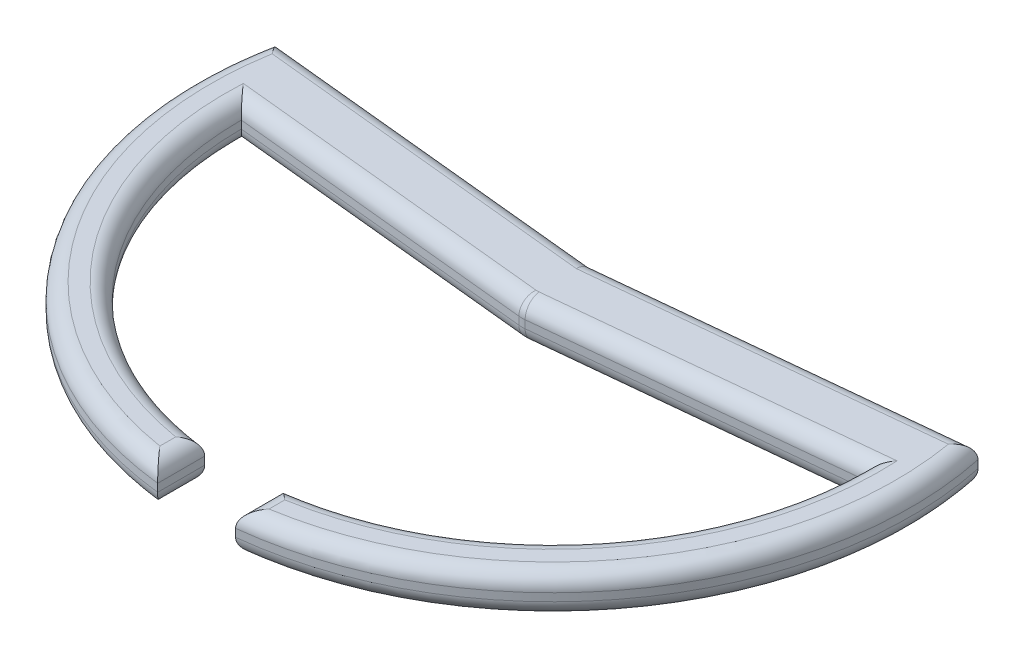
from build123d import *

# Parameters (mm, degrees)
BOSS_EXTRUDE1_DEPTH = 2.5
FILLET1_R           = 2


with BuildPart() as part:
    # Sketch1 → Boss-Extrude1 (new, symmetric)
    with BuildSketch(Plane(origin=(0, 0, 0), x_dir=(1, 0, 0), z_dir=(0, 1, 0))):
        with BuildLine():
            Line((-40, 0), (-0.4, -3.979949748))
            ThreePointArc((-0.4, -3.979949748), (0, -4), (0.4, -3.979949748))
            Line((0.4, -3.979949748), (40, 0))
            ThreePointArc((40, 0), (30, -26.457513111), (5, -39.686269666))
            Line((5, -39.686269666), (5, -45.727453461))
            ThreePointArc((5, -45.727453461), (37.25909777, -26.977020468), (45.00346781, 9.523018697))
            Line((45.00346781, 9.523018697), (0, 5))
            Line((0, 5), (-45.00346781, 9.523018697))
            ThreePointArc((-45.00346781, 9.523018697), (-37.25909777, -26.977020468), (-5, -45.727453461))
            Line((-5, -45.727453461), (-5, -39.686269666))
            ThreePointArc((-5, -39.686269666), (-30, -26.457513111), (-40, 0))
        make_face()
    extrude(amount=BOSS_EXTRUDE1_DEPTH, both=True)

    # Fillet1
    fillet1_edges = [part.edges().sort_by_distance(p)[0] for p in [
        (20.2, 2.5, 1.989974874),
        (-20.2, -2.5, 1.989974874),
        (-30, -2.5, 26.457513111),
        (-5, -2.5, 42.706861563),
        (-37.25909777, -2.5, 26.977020468),
        (-22.501733905, -2.5, -7.261509348),
        (22.501733905, -2.5, -7.261509348),
        (30, 2.5, 26.457513111),
        (37.25909777, -2.5, 26.977020468),
        (5, -2.5, 42.706861563),
        (30, -2.5, 26.457513111),
        (20.2, -2.5, 1.989974874),
        (0, -2.5, 4),
        (5, 2.5, 42.706861563),
        (37.25909777, 2.5, 26.977020468),
        (22.501733905, 2.5, -7.261509348),
        (-22.501733905, 2.5, -7.261509348),
        (-37.25909777, 2.5, 26.977020468),
        (-5, 2.5, 42.706861563),
        (0, 2.5, 4),
        (-30, 2.5, 26.457513111),
        (-20.2, 2.5, 1.989974874),
    ]]
    fillet(fillet1_edges, radius=FILLET1_R)


solid = part.part
